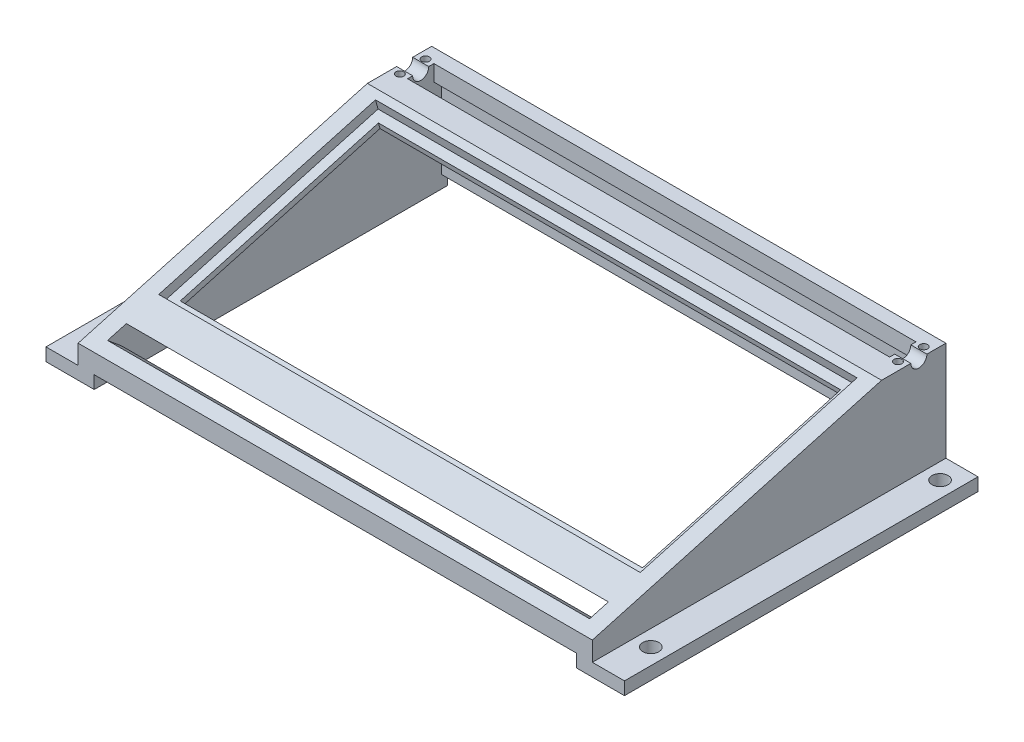
from build123d import *

# Parameters (mm, degrees)
CUT_EXTRUDE1_START          = -6.35
CUT_EXTRUDE1_DEPTH          = 190.5
BOSS_EXTRUDE4_REACH         = 233.927
BOSS_EXTRUDE5_DEPTH         = 25.4
SKETCH3_W                   = 2.54
SKETCH3_H                   = 39.37
BOSS_EXTRUDE1_DEPTH         = 95.25
SKETCH11_R                  = 3.175
CUT_EXTRUDE6_DEPTH          = 251.563629798
SKETCH12_R                  = 1.524
CUT_EXTRUDE7_DEPTH          = 10.16
SKETCH5_W                   = 190.291482803
SKETCH5_H                   = 88.9
CUT_EXTRUDE2_DEPTH          = 3.81
SKETCH6_W                   = 182.671482803
SKETCH6_H                   = 81.28
CUT_EXTRUDE3_DEPTH          = 12.7
SKETCH14_W                  = 190.5
SKETCH14_H                  = 10.414
CUT_EXTRUDE8_DEPTH          = 179.366063356
SKETCH15_W                  = 139.7
SKETCH15_H                  = 5.08
BOSS_EXTRUDE6_DEPTH         = 12.7
F_1_4_0_25_DIAMETER_HOLE1_D = 6.35


with BuildPart() as part:
    # Sketch1 → Loft1 section 0
    with BuildSketch(Plane.XY):
        with BuildLine():
            Line((101.6, 0), (101.6, 12.7))
            Line((101.6, 12.7), (-101.6, 12.7))
            Line((-101.6, 12.7), (-101.6, 0))
            Line((-101.6, 0), (-95.25, 0))
            Line((-95.25, 0), (-95.25, 6.35))
            Line((-95.25, 6.35), (95.25, 6.35))
            Line((95.25, 6.35), (95.25, 0))
            Line((95.25, 0), (101.6, 0))
        make_face()
    # Sketch2 → Loft1 section 1
    with BuildSketch(Plane.XY.offset(-114.3)):
        with BuildLine():
            Line((-95.25, 0), (-95.25, 38.1))
            Line((-95.25, 38.1), (95.25, 38.1))
            Line((95.25, 38.1), (95.25, 0))
            Line((95.25, 0), (101.6, 0))
            Line((101.6, 0), (101.6, 44.45))
            Line((101.6, 44.45), (-101.6, 44.45))
            Line((-101.6, 44.45), (-101.6, 0))
            Line((-101.6, 0), (-95.25, 0))
        make_face()
    loft()

    # Sketch4 → Cut-Extrude1 (cut)
    with BuildSketch(Plane(origin=(101.6, 0, 0), x_dir=(0, 0, -1), z_dir=(1, 0, 0)).offset(CUT_EXTRUDE1_START)):
        Polygon((12.7, 32.737292081), (5.278114464, 32.737292081), (5.278114464, 14.166142907), (15.549865586, 5.547120329), (19.654278654, 10.392445124), (12.7, 16.227777778), align=None)
    extrude(amount=-CUT_EXTRUDE1_DEPTH, mode=Mode.SUBTRACT)

    # Sketch7 → Boss-Extrude4 (add, up to next)
    with BuildSketch(Plane.ZY.offset(-95.25), mode=Mode.PRIVATE) as boss_extrude4_sk1:
        Polygon((0, 6.35), (-2.44733549, 7.029815414), (-2.44733549, 5.08), (0, 5.08), align=None)
    boss_extrude4_tool1 = extrude(boss_extrude4_sk1.sketch, amount=BOSS_EXTRUDE4_REACH, mode=Mode.PRIVATE) - part.part
    add(boss_extrude4_tool1.solids().sort_by_distance((95.25, 5.896915, -1.309787))[0])

    # Sketch9 → Boss-Extrude5 (add)
    with BuildSketch(Plane(origin=(0, 0, -114.3), x_dir=(-1, 0, 0), z_dir=(0, 0, -1))):
        Polygon((-95.25, 0), (-101.6, 0), (-101.6, 44.45), (101.6, 44.45), (101.6, 0), (95.25, 0), (95.25, 38.1), (-95.25, 38.1), align=None)
    extrude(amount=BOSS_EXTRUDE5_DEPTH)

    # Sketch3 → Boss-Extrude1 (add, symmetric)
    with BuildSketch(Plane(origin=(0, 0, 0), x_dir=(0, 0, -1), z_dir=(1, 0, 0))):
        with Locations((138.43, 24.765)):
            Rectangle(SKETCH3_W, SKETCH3_H)
    extrude(amount=BOSS_EXTRUDE1_DEPTH, both=True)

    # Sketch11 → Cut-Extrude6 (cut, through all)
    with BuildSketch(Plane.ZY.offset(101.6)):
        with Locations((-129.032, 44.45)):
            Circle(SKETCH11_R)
    extrude(amount=-CUT_EXTRUDE6_DEPTH, mode=Mode.SUBTRACT)

    # Sketch12 → Cut-Extrude7 (cut)
    with BuildSketch(Plane(origin=(0, 44.45, 0), x_dir=(1, 0, 0), z_dir=(0, 1, 0))):
        with Locations(Location((98.425, 123.952, 0), (0, 0, 180))):
            Circle(SKETCH12_R)
        with Locations((98.425, 134.112)):
            Circle(SKETCH12_R)
        with Locations(Location((-98.425, 134.112, 0), (0, 0, 180))):
            Circle(SKETCH12_R)
        with Locations((-98.425, 123.952)):
            Circle(SKETCH12_R)
    extrude(amount=-CUT_EXTRUDE7_DEPTH, mode=Mode.SUBTRACT)

    # Sketch5 → Cut-Extrude2 (cut)
    with BuildSketch(Plane(origin=(0, 11.79025788, 3.275071633), x_dir=(1, 0, 0), z_dir=(0, 0.9635179096299408, 0.2676438637860946))):
        with Locations((-0.104258598, 74.316283438)):
            Rectangle(SKETCH5_W, SKETCH5_H)
    extrude(amount=-CUT_EXTRUDE2_DEPTH, mode=Mode.SUBTRACT)

    # Sketch6 → Cut-Extrude3 (cut)
    with BuildSketch(Plane(origin=(0, 8.119254644, 2.255348512), x_dir=(1, 0, 0), z_dir=(0, 0.9635179096299407, 0.26764386378609456))):
        with Locations((-0.104258599, 74.316283438)):
            Rectangle(SKETCH6_W, SKETCH6_H)
    extrude(amount=-CUT_EXTRUDE3_DEPTH, mode=Mode.SUBTRACT)

    # Sketch14 → Cut-Extrude8 (cut, through all)
    with BuildSketch(Plane(origin=(0, 44.45, 0), x_dir=(1, 0, 0), z_dir=(0, 1, 0))):
        with Locations((0, 129.032)):
            Rectangle(SKETCH14_W, SKETCH14_H)
    extrude(amount=-CUT_EXTRUDE8_DEPTH, mode=Mode.SUBTRACT)

    # Sketch15 → Boss-Extrude6 (add)
    with BuildSketch(Plane(origin=(101.6, 0, 0), x_dir=(0, 0, -1), z_dir=(1, 0, 0))):
        with Locations((69.85, 2.54)):
            Rectangle(SKETCH15_W, SKETCH15_H)
    boss_extrude6 = extrude(amount=BOSS_EXTRUDE6_DEPTH)

    # 1/4 (0.25) Diameter Hole1 (through all)
    with Locations(Plane(origin=(0, 5.08, 0), x_dir=(1, 0, 0), z_dir=(0, 1, 0))):
        with Locations((107.95, 16.757307422), (107.95, 131.057307422)):
            f_1_4_0_25_diameter_hole1 = Hole(F_1_4_0_25_DIAMETER_HOLE1_D / 2)

    # Mirror1: Boss-Extrude6 across plane
    add(boss_extrude6.mirror(Plane(origin=(0, 0, 0), x_dir=(0, 0, 1), z_dir=(1, 0, 0))))

    # Mirror2: 1/4 (0.25) Diameter Hole1 across plane
    add(f_1_4_0_25_diameter_hole1.mirror(Plane(origin=(0, 0, 0), x_dir=(0, 0, 1), z_dir=(1, 0, 0))), mode=Mode.SUBTRACT)


solid = part.part
